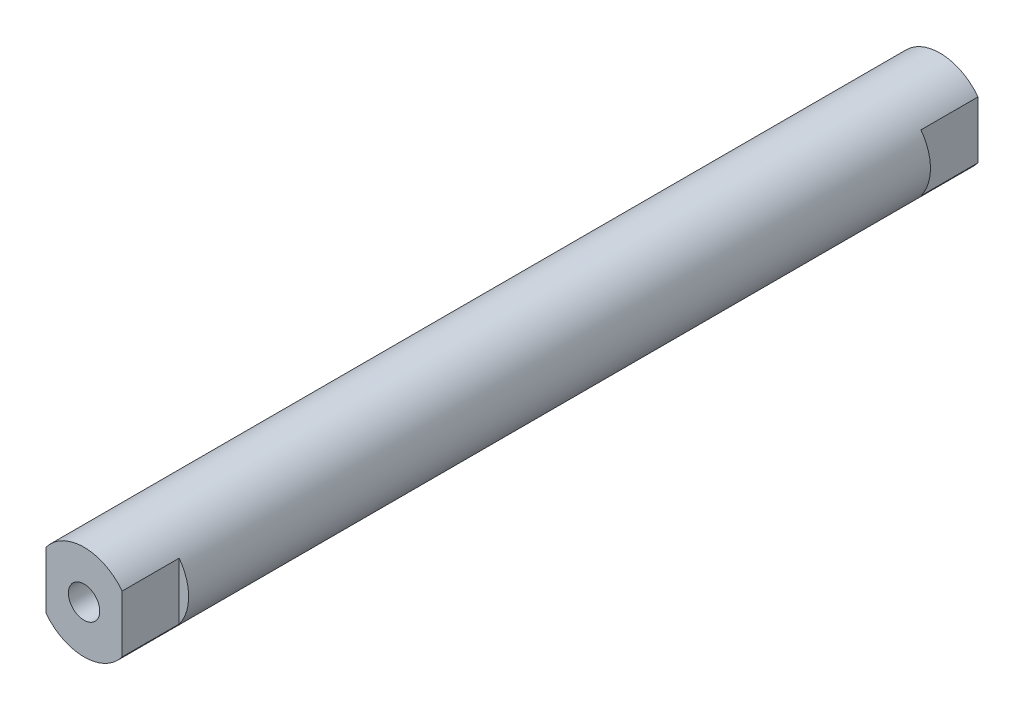
from build123d import *

# Parameters (mm, degrees)
SKETCH_1_R          = 5
EXTRUDE_1_DEPTH     = 45
CUT_EXTRUDE_1_DEPTH = 6


with BuildPart() as part:
    # 草图1 → 凸台-拉伸1 (new, symmetric)
    with BuildSketch(Plane.XY):
        with Locations(Location((0, 0, 0), (0, 0, 180))):
            Circle(SKETCH_1_R)
    extrude(amount=EXTRUDE_1_DEPTH, both=True)

    # 草图2 → 切除-拉伸1 (cut)
    with BuildSketch(Plane.XY.offset(45)):
        with BuildLine():
            Line((-4, -3), (-4, 3))
            ThreePointArc((-4, 3), (-5, 0), (-4, -3))
        make_face()
        with BuildLine():
            Line((4, -3), (4, 3))
            ThreePointArc((4, 3), (5, 0), (4, -3))
        make_face()
    cut_extrude_1 = extrude(amount=-CUT_EXTRUDE_1_DEPTH, mode=Mode.SUBTRACT)

    # 草图3 → M4 螺纹孔1 (revolve, cut)
    with BuildSketch(Plane(origin=(0, 0, 45), x_dir=(0, -1, 0), z_dir=(1, 0, 0))):
        Polygon((0, 0), (0, 11.091420021), (1.65, 10.1), (1.65, 0), align=None)
    hole_wizard_m4_1 = revolve(axis=Axis((0, 0, 51.35), (0, 0, -1)), mode=Mode.SUBTRACT)

    # 镜向1: 切除-拉伸1, M4 螺纹孔1 across plane
    add(cut_extrude_1.mirror(Plane.XY), mode=Mode.SUBTRACT)
    add(hole_wizard_m4_1.mirror(Plane.XY), mode=Mode.SUBTRACT)


solid = part.part
